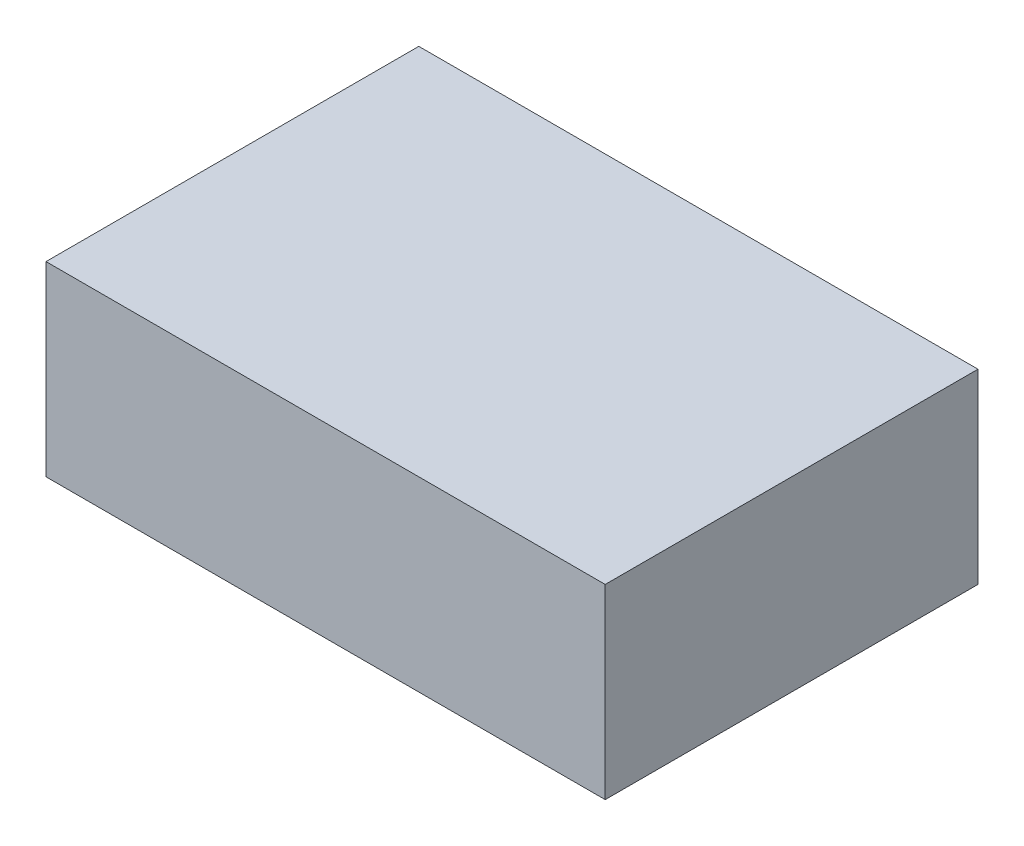
from build123d import *

# Parameters (mm, degrees)
SKETCH1_W           = 30
SKETCH1_H           = 10
BOSS_EXTRUDE1_DEPTH = 20


with BuildPart() as part:
    # Sketch1 → Boss-Extrude1 (new body)
    with BuildSketch(Plane.XY):
        Rectangle(SKETCH1_W, SKETCH1_H)
    extrude(amount=-BOSS_EXTRUDE1_DEPTH)


solid = part.part
